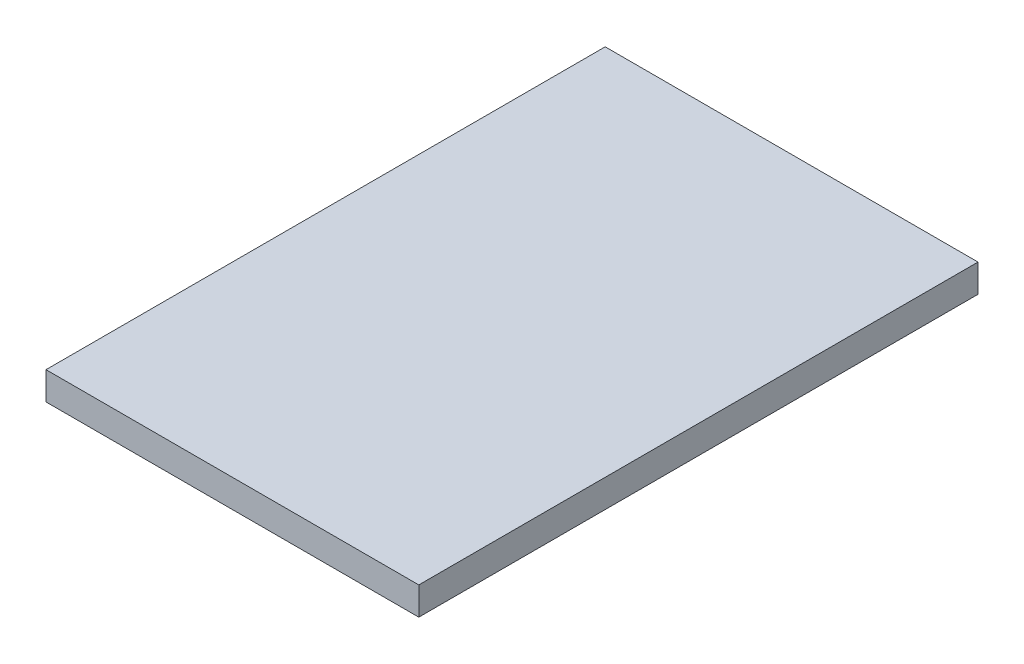
from build123d import *

# Parameters (mm, degrees)
SKETCH1_W           = 254
SKETCH1_H           = 381
BOSS_EXTRUDE1_DEPTH = 19.05


with BuildPart() as part:
    # Sketch1 → Boss-Extrude1 (new body)
    with BuildSketch(Plane(origin=(0, 0, 0), x_dir=(1, 0, 0), z_dir=(0, 1, 0))):
        with Locations((127, 190.5)):
            Rectangle(SKETCH1_W, SKETCH1_H)
    extrude(amount=BOSS_EXTRUDE1_DEPTH)


solid = part.part
